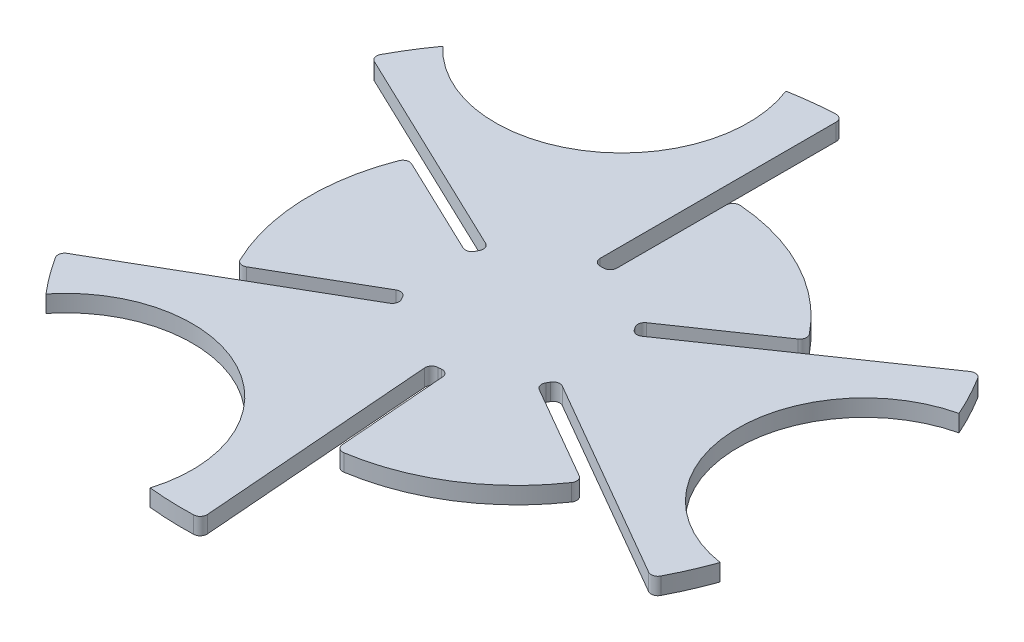
from build123d import *

# Parameters (mm, degrees)
EXTRUDE_1_DEPTH = 5
EXTRUDE_2_DEPTH = 5
FILLET_1_R      = 2


with BuildPart() as part:
    # 草圖1 → 填料-伸長1 (new body)
    with BuildSketch(Plane(origin=(0, 0, 0), x_dir=(1, 0, 0), z_dir=(0, 1, 0))):
        with BuildLine():
            Line((54.466538783, -28.559519482), (22.900635095, -10.334936491))
            Line((22.900635095, -10.334936491), (20.400635095, -14.665063509))
            Line((20.400635095, -14.665063509), (51.966538783, -32.889646501))
            ThreePointArc((51.966538783, -32.889646501), (32.8, -52.023167916), (7.272937851, -61.06844009))
            Line((7.272937851, -61.06844009), (4.437329437, -24.729741355))
            Line((4.437329437, -24.729741355), (-0.547516958, -25.118722602))
            Line((-0.547516958, -25.118722602), (2.288091456, -61.457421338))
            ThreePointArc((2.288091456, -61.457421338), (-28.653385, -54.417217202), (-51.966538783, -32.889646501))
            Line((-51.966538783, -32.889646501), (-20.400635095, -14.665063509))
            Line((-20.400635095, -14.665063509), (-22.900635095, -10.334936491))
            Line((-22.900635095, -10.334936491), (-54.466538783, -28.559519482))
            ThreePointArc((-54.466538783, -28.559519482), (-61.453385, -2.394049286), (-56.523289413, 24.235671105))
            Line((-56.523289413, 24.235671105), (-23.635248961, 8.522030659))
            Line((-23.635248961, 8.522030659), (-21.479693405, 13.033524896))
            Line((-21.479693405, 13.033524896), (-54.367733857, 28.747165342))
            ThreePointArc((-54.367733857, 28.747165342), (-32.8, 52.023167916), (-2.5, 61.449165983))
            Line((-2.5, 61.449165983), (-2.5, 25))
            Line((-2.5, 25), (2.5, 25))
            Line((2.5, 25), (2.5, 61.449165983))
            ThreePointArc((2.5, 61.449165983), (28.653385, 54.417217202), (49.250351562, 36.832768984))
            Line((49.250351562, 36.832768984), (19.197919523, 16.207710695))
            Line((19.197919523, 16.207710695), (22.027210363, 12.085197706))
            Line((22.027210363, 12.085197706), (52.079642402, 32.710255996))
            ThreePointArc((52.079642402, 32.710255996), (61.453385, 2.394049286), (54.466538783, -28.559519482))
        make_face()
    extrude(amount=-EXTRUDE_1_DEPTH)

    # 草圖2 → 填料-伸長2 (add)
    with BuildSketch(Plane(origin=(0, 0, 0), x_dir=(1, 0, 0), z_dir=(0, 1, 0))):
        with BuildLine():
            ThreePointArc((-28.653383827, -54.41721782), (-41.72232091, -45.182938571), (-51.966538783, -32.889646501))
            Line((-51.966538783, -32.889646501), (-84.459173955, -51.649278164))
            ThreePointArc((-84.459173955, -51.649278164), (-80.172265021, -58.081046146), (-75.396639607, -64.158761958))
            ThreePointArc((-75.396639607, -64.158761958), (-53.775779243, -50.887209365), (-28.653383827, -54.41721782))
        make_face()
        with BuildLine():
            ThreePointArc((2.288091456, -61.457421338), (-13.644532856, -59.967297114), (-28.653383827, -54.41721782))
            ThreePointArc((-28.653383827, -54.41721782), (-11.527171875, -73.133213972), (-10.235261538, -98.469484721))
            ThreePointArc((-10.235261538, -98.469484721), (-2.521842415, -98.967875146), (5.20694943, -98.86297425))
            Line((5.20694943, -98.86297425), (2.288091456, -61.457421338))
        make_face()
        with BuildLine():
            ThreePointArc((61.453385072, 2.394047453), (59.990732727, -13.541122069), (54.466538783, -28.559519482))
            Line((54.466538783, -28.559519482), (86.959173955, -47.319151145))
            ThreePointArc((86.959173955, -47.319151145), (90.385793951, -40.390695114), (93.261437534, -33.216024281))
            ThreePointArc((93.261437534, -33.216024281), (70.957506712, -21.127587428), (61.453385072, 2.394047453))
        make_face()
        with BuildLine():
            ThreePointArc((52.079642402, 32.710255996), (58.755469592, 18.167134971), (61.453385072, 2.394047453))
            ThreePointArc((61.453385072, 2.394047453), (69.09880614, 26.583782051), (90.394706035, 40.370745854))
            ThreePointArc((90.394706035, 40.370745854), (86.969615242, 47.299957977), (83.01437248, 53.940837608))
            Line((83.01437248, 53.940837608), (52.079642402, 32.710255996))
        make_face()
        with BuildLine():
            ThreePointArc((-32.800000376, 52.023167679), (-18.268411744, 58.724059229), (-2.5, 61.449165983))
            Line((-2.5, 61.449165983), (-2.5, 98.96842931))
            ThreePointArc((-2.5, 98.96842931), (-10.21352893, 98.47174126), (-17.864797927, 97.374786239))
            ThreePointArc((-17.864797927, 97.374786239), (-17.181726279, 72.014796034), (-32.800000376, 52.023167679))
        make_face()
        with BuildLine():
            ThreePointArc((-54.367733857, 28.747165342), (-45.110935969, 41.800160956), (-32.800000376, 52.023167679))
            ThreePointArc((-32.800000376, 52.023167679), (-57.571634785, 46.549430608), (-80.159444497, 58.098738867))
            ThreePointArc((-80.159444497, 58.098738867), (-84.447772827, 51.667917169), (-88.221321909, 44.922136643))
            Line((-88.221321909, 44.922136643), (-54.367733857, 28.747165342))
        make_face()
    extrude(amount=-EXTRUDE_2_DEPTH)

    # 圓角1
    fillet_1_edges = [part.edges().sort_by_distance(p)[0] for p in [
        (83.01437248, -2.5, -53.940837608),
        (-2.5, -2.5, -98.96842931),
        (-88.221321909, -2.5, -44.922136643),
        (4.437329437, -2.5, 24.729741355),
        (-0.547516958, -2.5, 25.118722602),
        (-20.400635095, -2.5, 14.665063509),
        (-22.900635095, -2.5, 10.334936491),
        (-54.466538783, -2.5, 28.559519482),
        (-56.523289413, -2.5, -24.235671105),
        (-23.635248961, -2.5, -8.522030659),
        (-21.479693405, -2.5, -13.033524896),
        (-2.5, -2.5, -25),
        (2.5, -2.5, -25),
        (2.5, -2.5, -61.449165983),
        (49.250351562, -2.5, -36.832768984),
        (19.197919523, -2.5, -16.207710695),
        (22.027210363, -2.5, -12.085197706),
        (22.900635095, -2.5, 10.334936491),
        (20.400635095, -2.5, 14.665063509),
        (51.966538783, -2.5, 32.889646501),
        (7.272937851, -2.5, 61.06844009),
        (-84.459173955, -2.5, 51.649278164),
        (5.20694943, -2.5, 98.86297425),
        (86.959173955, -2.5, 47.319151145),
    ]]
    fillet(fillet_1_edges, radius=FILLET_1_R)


solid = part.part
